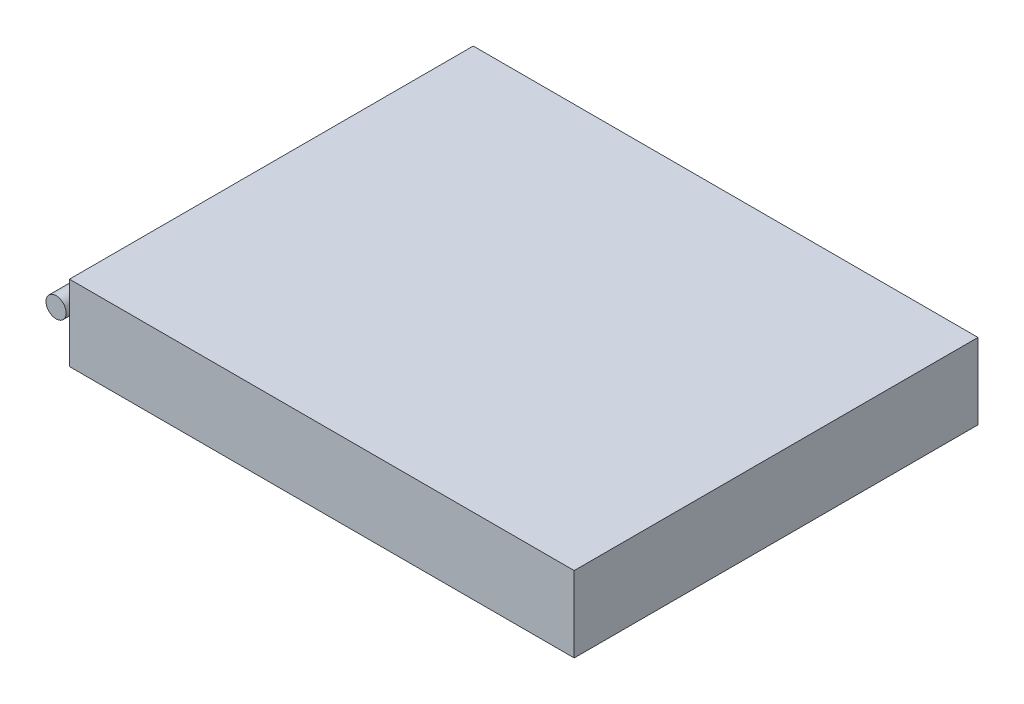
from build123d import *

# Parameters (mm, degrees)
SKETCH1_W           = 50
SKETCH1_H           = 40.00000001
BOSS_EXTRUDE1_DEPTH = 7.5
SKETCH2_R           = 1
SKETCH4_R           = 1


with BuildPart() as part:
    # Sketch1 → Boss-Extrude1 (new body)
    with BuildSketch(Plane(origin=(0, 0, 0), x_dir=(1, 0, 0), z_dir=(0, 1, 0))):
        with Locations((25, 20.000000005)):
            Rectangle(SKETCH1_W, SKETCH1_H)
    extrude(amount=BOSS_EXTRUDE1_DEPTH)

    # Sweep1: sweep along a path in Sketch3
    with BuildLine(Plane(origin=(0, 3.75, 0), x_dir=(1, 0, 0), z_dir=(0, 1, 0))) as sweep1_path:
        Line((0, 35.000000005), (-0.5, 35.000000005))
        ThreePointArc((-0.5, 35.000000005), (-1.560660172, 34.560660177), (-2, 33.500000005))
        Line((-2, 33.500000005), (-2, 10.000000005))
    # Sketch2 → Sweep1 (sweep)
    with BuildSketch(Plane.ZY):
        with Locations((-35.000000005, 3.75)):
            Circle(SKETCH2_R)
    sweep(path=sweep1_path.line)

    # Sweep2: sweep along a path in Sketch5
    with BuildLine(Plane(origin=(0, 3.75, 0), x_dir=(1, 0, 0), z_dir=(0, 1, 0))) as sweep2_path:
        Line((0, 5), (-0.5, 5))
        ThreePointArc((-0.5, 5), (-1.560660172, 4.560660172), (-2, 3.5))
        Line((-2, 3.5), (-2, 0.674549329))
    # Sketch4 → Sweep2 (sweep)
    with BuildSketch(Plane.ZY):
        with Locations((-5, 3.75)):
            Circle(SKETCH4_R)
    sweep(path=sweep2_path.line)


solid = part.part
